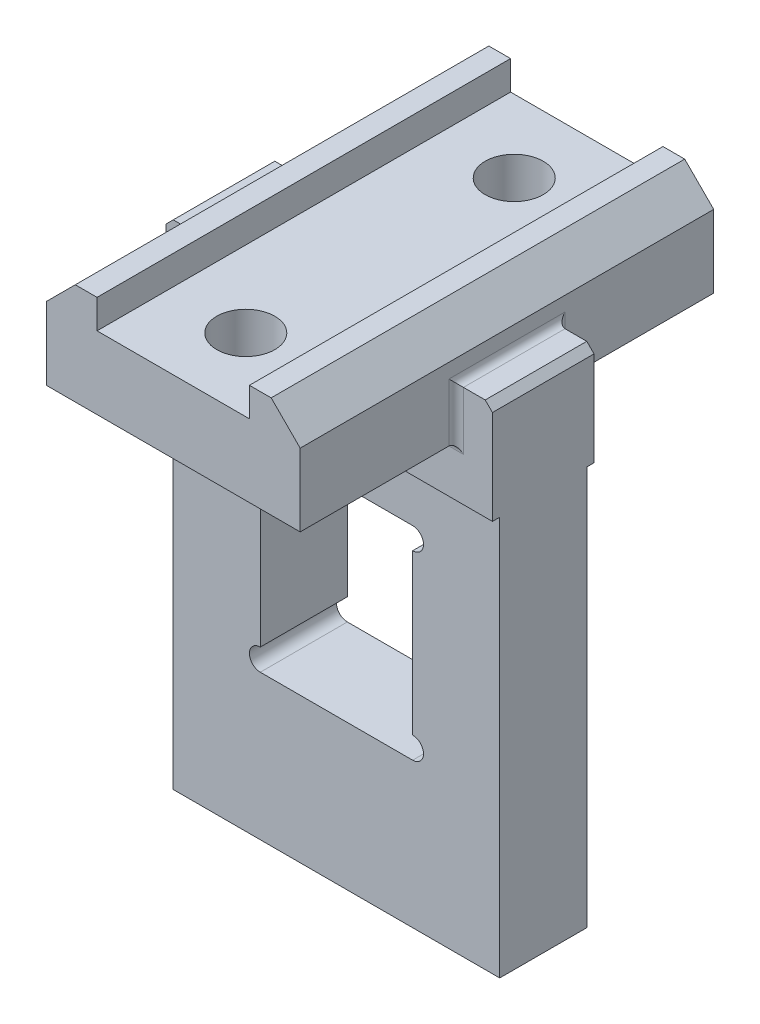
from build123d import *

# Parameters (mm, degrees)
SKETCH_2_W      = 45
SKETCH_2_H      = 55
EXTRUDE_1_DEPTH = 6
EXTRUDE_2_DEPTH = 7
EXTRUDE_3_DEPTH = 28.5
CHAMFER_1_SIZE  = 4
HOLE_WIZARD_1_D = 8
FILLET_1_R      = 1
CHAMFER_2_SIZE  = 1


with BuildPart() as part:
    # 스케치2 → 보스-돌출1 (new, symmetric)
    with BuildSketch(Plane.XY):
        with Locations((0, 27.5)):
            Rectangle(SKETCH_2_W, SKETCH_2_H)
        with BuildLine():
            Line((-10.5, 48), (10.5, 48))
            ThreePointArc((10.5, 48), (12, 46.5), (10.5, 45))
            Line((10.5, 45), (10.5, 23))
            ThreePointArc((10.5, 23), (12, 21.5), (10.5, 20))
            Line((10.5, 20), (-10.5, 20))
            ThreePointArc((-10.5, 20), (-12, 21.5), (-10.5, 23))
            Line((-10.5, 23), (-10.5, 45))
            ThreePointArc((-10.5, 45), (-12, 46.5), (-10.5, 48))
        make_face(mode=Mode.SUBTRACT)
    extrude(amount=EXTRUDE_1_DEPTH, both=True)

    # 스케치2<5> → 보스-돌출2 (add, symmetric)
    with BuildSketch(Plane.XY):
        Polygon((-22.5, 69), (-22.5, 55), (22.5, 55), (22.5, 69), (17.5, 69), (17.5, 62), (-17.5, 62), (-17.5, 69), align=None)
    extrude(amount=EXTRUDE_2_DEPTH, both=True)

    # 스케치2<6> → 보스-돌출3 (add, symmetric)
    with BuildSketch(Plane.XY):
        Polygon((-17.5, 62), (17.5, 62), (17.5, 76), (10.5, 76), (10.5, 72), (-10.5, 72), (-10.5, 76), (-17.5, 76), align=None)
    extrude(amount=EXTRUDE_3_DEPTH, both=True)

    # 모따기1
    chamfer_1_edges = [part.edges().sort_by_distance(p)[0] for p in [
        (17.5, 76, 0),
        (-17.5, 76, 0),
    ]]
    chamfer(chamfer_1_edges, length=CHAMFER_1_SIZE)

    # 구멍1 (through all)
    with Locations(Plane(origin=(0, 72, 0), x_dir=(1, 0, 0), z_dir=(0, 1, 0))):
        with Locations((0, 18.5), (0, -18.5)):
            Hole(HOLE_WIZARD_1_D / 2)

    # 필렛1
    fillet_1_edges = [part.edges().sort_by_distance(p)[0] for p in [
        (0, 62, 7),
        (-17.5, 65.5, 7),
        (-17.5, 69, 0),
        (-17.5, 65.5, -7),
        (0, 62, -7),
        (17.5, 65.5, -7),
        (17.5, 65.5, 7),
        (17.5, 69, 0),
    ]]
    fillet(fillet_1_edges, radius=FILLET_1_R)

    # 모따기2
    chamfer_2_edges = [part.edges().sort_by_distance(p)[0] for p in [
        (-22.5, 69, 0),
        (22.5, 69, 0),
    ]]
    chamfer(chamfer_2_edges, length=CHAMFER_2_SIZE)


solid = part.part
